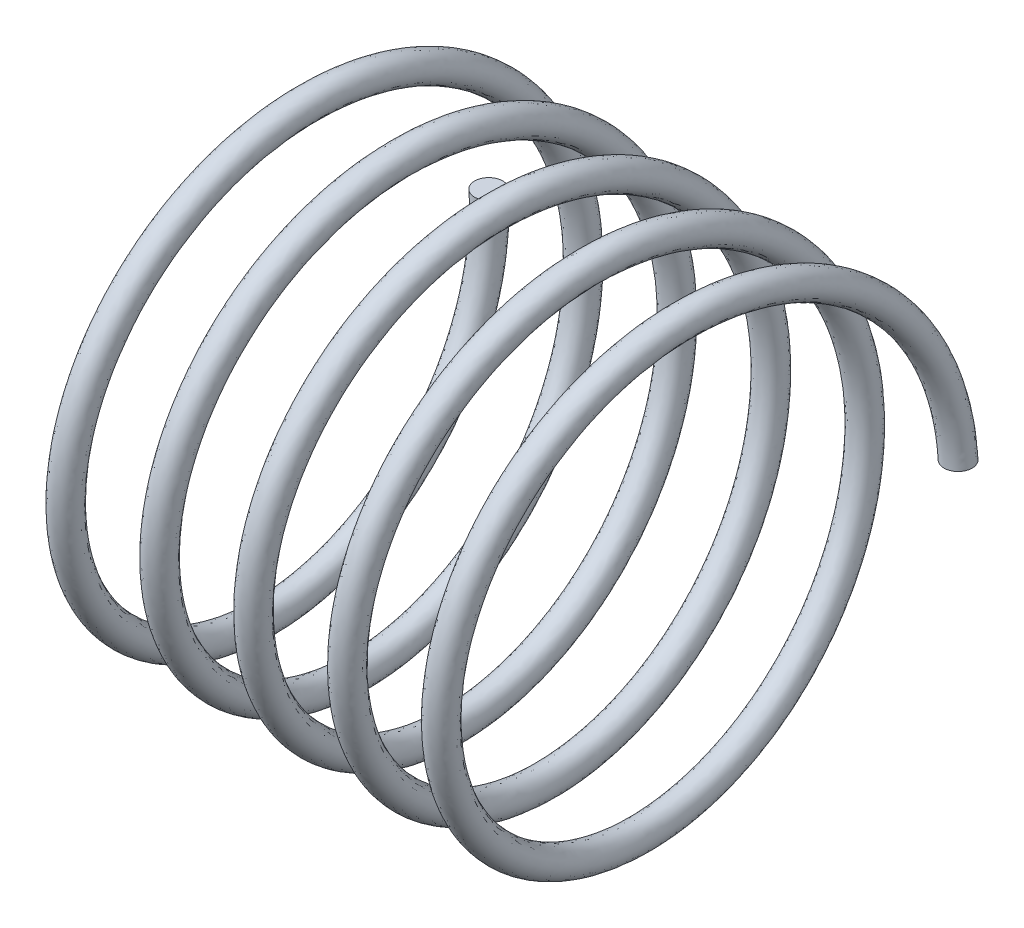
from build123d import *

# Parameters (mm, degrees)
SWEEP1_PITCH       = 10
SWEEP1_HEIGHT      = 50
SWEEP1_RADIUS      = 25
SWEEP1_START_ANGLE = 180
SKETCH5_R          = 1.5


with BuildPart() as part:
    # Sweep1: sweep along a helix
    with BuildLine() as sweep1_path:
        add(Helix(SWEEP1_PITCH, SWEEP1_HEIGHT, SWEEP1_RADIUS, center=(0, 0, 0), direction=(1, 0, 0), lefthand=True, mode=Mode.PRIVATE).rotate(Axis((0, 0, 0), (1, 0, 0)), SWEEP1_START_ANGLE))
    # Sketch5 → Sweep1 (sweep)
    with BuildSketch(Plane(origin=(0, 0, 0), x_dir=(1, 0, 0), z_dir=(0, 1, 0))):
        with Locations((50, 25)):
            Circle(SKETCH5_R)
    sweep(path=sweep1_path.line, is_frenet=True)


solid = part.part
